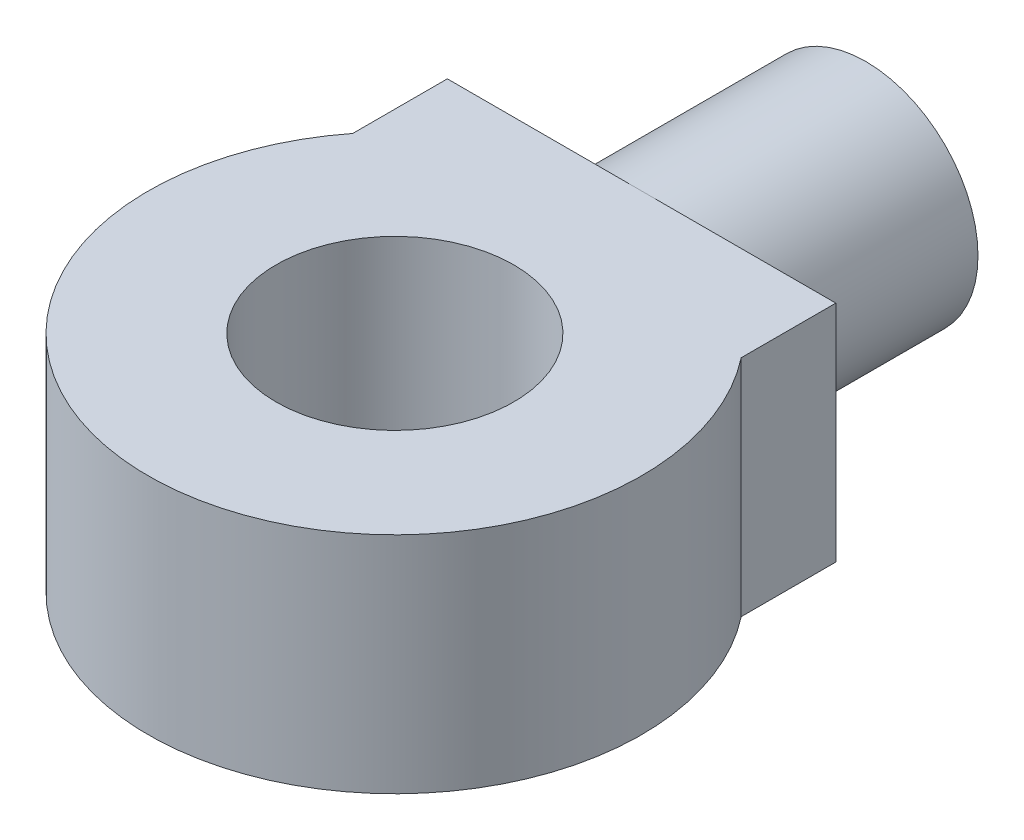
from build123d import *

# Parameters (mm, degrees)
SKETCH1_R           = 2.5
BOSS_EXTRUDE1_DEPTH = 5
SKETCH2_W           = 8.660254038
SKETCH2_H           = 5
BOSS_EXTRUDE2_DEPTH = 5
SKETCH3_R           = 5.5
BOSS_EXTRUDE3_DEPTH = 5
SKETCH4_R           = 2.65
CUT_EXTRUDE1_DEPTH  = 31.205316798


with BuildPart() as part:
    # Sketch1 → Boss-Extrude1 (new body)
    with BuildSketch(Plane.XY.offset(2.596184677)):
        with Locations((21.004809472, 129.315154096)):
            Circle(SKETCH1_R)
    extrude(amount=-BOSS_EXTRUDE1_DEPTH)

    # Sketch2 → Boss-Extrude2 (add)
    with BuildSketch(Plane.XY.offset(2.596184677)):
        with Locations((21.004809472, 129.315154096)):
            Rectangle(SKETCH2_W, SKETCH2_H)
    extrude(amount=BOSS_EXTRUDE2_DEPTH)

    # Sketch3 → Boss-Extrude3 (add)
    with BuildSketch(Plane(origin=(0, 131.815154096, 0), x_dir=(1, 0, 0), z_dir=(0, 1, 0))):
        with Locations((21.004809472, -8.096184677)):
            Circle(SKETCH3_R)
    extrude(amount=-BOSS_EXTRUDE3_DEPTH)

    # Sketch4 → Cut-Extrude1 (cut, through all)
    with BuildSketch(Plane(origin=(0, 131.815154096, 0), x_dir=(1, 0, 0), z_dir=(0, 1, 0))):
        with Locations(Location((21.004809472, -8.096184677, 0), (0, 0, 270))):
            Circle(SKETCH4_R)
    extrude(amount=-CUT_EXTRUDE1_DEPTH, mode=Mode.SUBTRACT)


with BuildPart() as part_1:
    # Body-Move/Copy1: moved
    add(part.part.moved(Location((-21, -129.32, -8.1))))


solid = part_1.part
